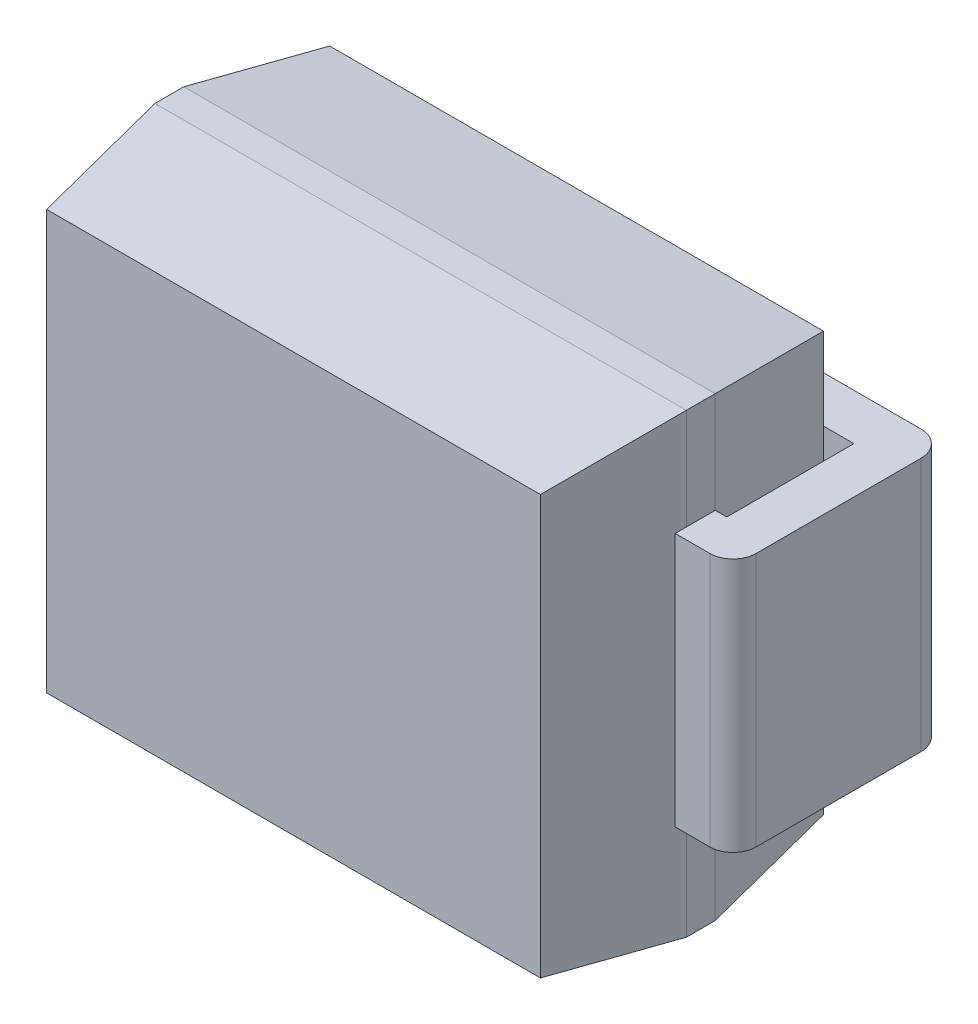
from build123d import *
from OCP.BRepFilletAPI import BRepFilletAPI_MakeChamfer

# Parameters (mm, degrees)
SKETCH_1_W           = 4.6
SKETCH_1_H           = 3.95
EXTRUDE_1_DEPTH      = 2.45
CHAMFER_1_SIZE       = 1.1
CHAMFER_1_SIZE2      = 0.163
CHAMFER_2_SIZE       = 0.163
CHAMFER_2_SIZE2      = 1.1
EXTRUDE_2_DEPTH      = 1.1
EXTRUDE_2_DEPTH_BACK = 1.1


with BuildPart() as part:
    # Эскиз1 → Бобышка-Вытянуть1 (new body)
    with BuildSketch(Plane.XY.offset(0.4)):
        Rectangle(SKETCH_1_W, SKETCH_1_H)
    extrude(amount=EXTRUDE_1_DEPTH)

    # Фаска1: one chamfer whose edges measure the first distance from different faces: ONE call of the kernel's chamfer builder (chamfer() names one face for all edges)
    chamfer_1_edges_1 = [part.edges().sort_by_distance(p)[0] for p in [
        (-2.3, 0, 2.85),
    ]]
    chamfer_1_side_1 = [part.faces().sort_by_distance(p)[0] for p in [
        (-2.3, 0, 1.625),
    ]]
    chamfer_1_edges_2 = [part.edges().sort_by_distance(p)[0] for p in [
        (0, -1.975, 2.85),
    ]]
    chamfer_1_side_2 = [part.faces().sort_by_distance(p)[0] for p in [
        (0, -1.975, 1.625),
    ]]
    chamfer_1_edges_3 = [part.edges().sort_by_distance(p)[0] for p in [
        (2.3, 0, 2.85),
    ]]
    chamfer_1_side_3 = [part.faces().sort_by_distance(p)[0] for p in [
        (2.3, 0, 1.625),
    ]]
    chamfer_1_edges_4 = [part.edges().sort_by_distance(p)[0] for p in [
        (0, 1.975, 2.85),
    ]]
    chamfer_1_side_4 = [part.faces().sort_by_distance(p)[0] for p in [
        (0, 1.975, 1.625),
    ]]
    chamfer_1 = BRepFilletAPI_MakeChamfer(part.part.solid().wrapped)
    for e in chamfer_1_edges_1:
        chamfer_1.Add(CHAMFER_1_SIZE, CHAMFER_1_SIZE2, e.wrapped, chamfer_1_side_1[0].wrapped)  # the first distance lies on this face
    for e in chamfer_1_edges_2:
        chamfer_1.Add(CHAMFER_1_SIZE, CHAMFER_1_SIZE2, e.wrapped, chamfer_1_side_2[0].wrapped)  # the first distance lies on this face
    for e in chamfer_1_edges_3:
        chamfer_1.Add(CHAMFER_1_SIZE, CHAMFER_1_SIZE2, e.wrapped, chamfer_1_side_3[0].wrapped)  # the first distance lies on this face
    for e in chamfer_1_edges_4:
        chamfer_1.Add(CHAMFER_1_SIZE, CHAMFER_1_SIZE2, e.wrapped, chamfer_1_side_4[0].wrapped)  # the first distance lies on this face
    add(Compound.cast(chamfer_1.Shape()), mode=Mode.REPLACE)

    # Фаска2
    chamfer_2_edges = [part.edges().sort_by_distance(p)[0] for p in [
        (0, -1.975, 0.4),
        (-2.3, 0, 0.4),
        (0, 1.975, 0.4),
        (2.3, 0, 0.4),
    ]]
    chamfer_2_side = [part.faces().sort_by_distance(p)[0] for p in [
        (0, 0, 0.4),
    ]]
    chamfer(chamfer_2_edges, length=CHAMFER_2_SIZE, length2=CHAMFER_2_SIZE2, reference=chamfer_2_side[0])


with BuildPart() as body_2:
    # Эскиз2 → Бобышка-Вытянуть2 (new, two sides: drawn at the far end of the back side and taken through both)
    with BuildSketch(Plane(origin=(0, 0, 0), x_dir=(1, 0, 0), z_dir=(0, 1, 0)).offset(-EXTRUDE_2_DEPTH_BACK)):
        with BuildLine():
            Line((-2.4, -0.4), (-2.4, -1.5))
            Line((-2.4, -1.5), (-2.3, -1.5))
            Line((-2.3, -1.5), (-2.3, -1.846410162))
            Line((-2.3, -1.846410162), (-2.6, -1.846410162))
            ThreePointArc((-2.6, -1.846410162), (-2.741421356, -1.787831518), (-2.8, -1.646410162))
            Line((-2.8, -1.646410162), (-2.8, -0.22))
            ThreePointArc((-2.8, -0.22), (-2.735563492, -0.064436508), (-2.58, 0))
            Line((-2.58, 0), (-1.3, 0))
            Line((-1.3, 0), (-1.3, -0.4))
            Line((-1.3, -0.4), (-2.4, -0.4))
        make_face()
    extrude(amount=EXTRUDE_2_DEPTH + EXTRUDE_2_DEPTH_BACK)


with BuildPart() as body_3:
    # Зеркальное отражение1: mirrored copy
    add(body_2.part.mirror(Plane(origin=(0, 0, 0), x_dir=(0, 0, 1), z_dir=(1, 0, 0))))


solid = Compound([part.part, body_2.part, body_3.part])
